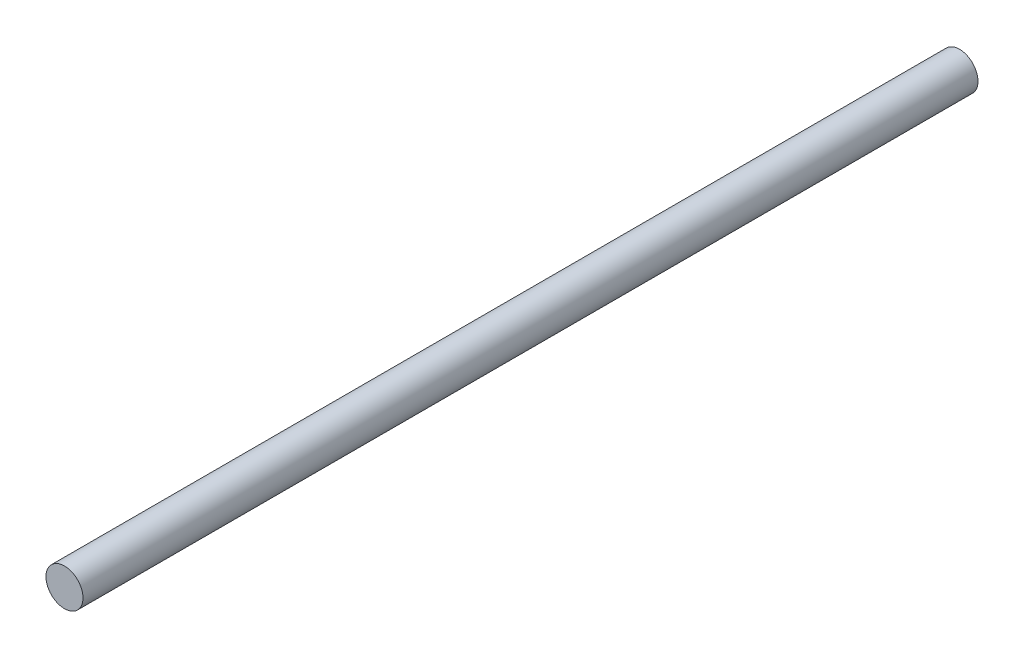
from build123d import *

# Parameters (mm, degrees)
ESQUISSE1_R        = 3
BOSS_EXTRU_1_DEPTH = 145


with BuildPart() as part:
    # Esquisse1 → Boss.-Extru.1 (new body)
    with BuildSketch(Plane.XY):
        Circle(ESQUISSE1_R)
    extrude(amount=BOSS_EXTRU_1_DEPTH)


solid = part.part
